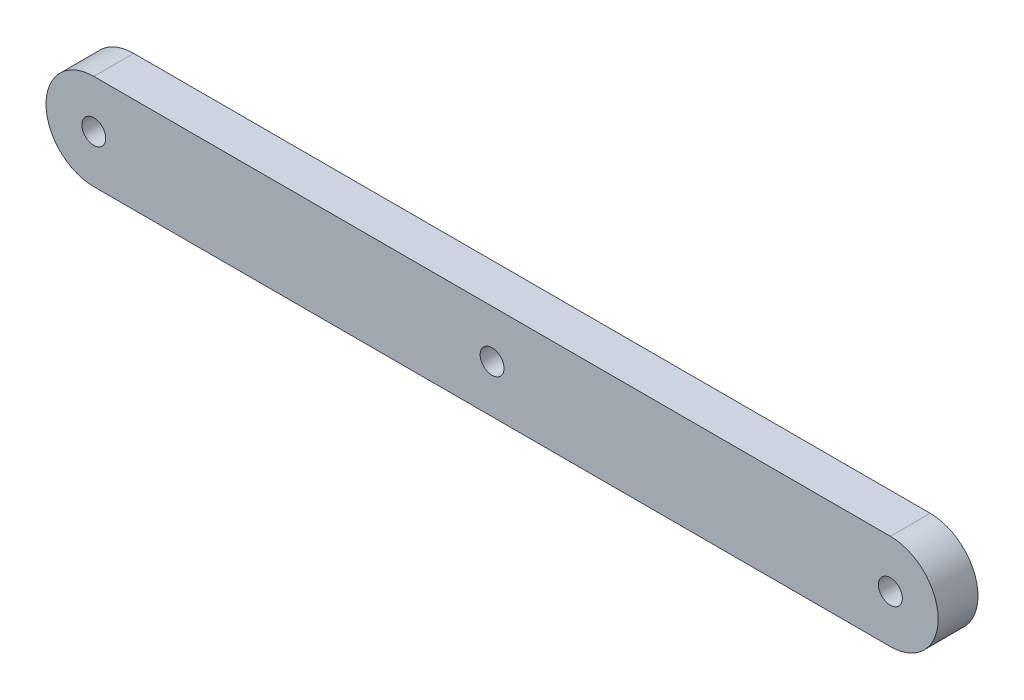
from build123d import *

# Parameters (mm, degrees)
ESQUISSE1_R        = 1.5
BOSS_EXTRU_1_DEPTH = 5


with BuildPart() as part:
    # Esquisse1 → Boss.-Extru.1 (new body)
    with BuildSketch(Plane.XY):
        with BuildLine():
            Line((-50, 6), (50, 6))
            ThreePointArc((50, 6), (56, 0), (50, -6))
            Line((50, -6), (-50, -6))
            ThreePointArc((-50, -6), (-56, 0), (-50, 6))
        make_face()
        with Locations((-50, 0)):
            Circle(ESQUISSE1_R, mode=Mode.SUBTRACT)
        with Locations((50, 0)):
            Circle(ESQUISSE1_R, mode=Mode.SUBTRACT)
        Circle(ESQUISSE1_R, mode=Mode.SUBTRACT)
    extrude(amount=BOSS_EXTRU_1_DEPTH)


solid = part.part
